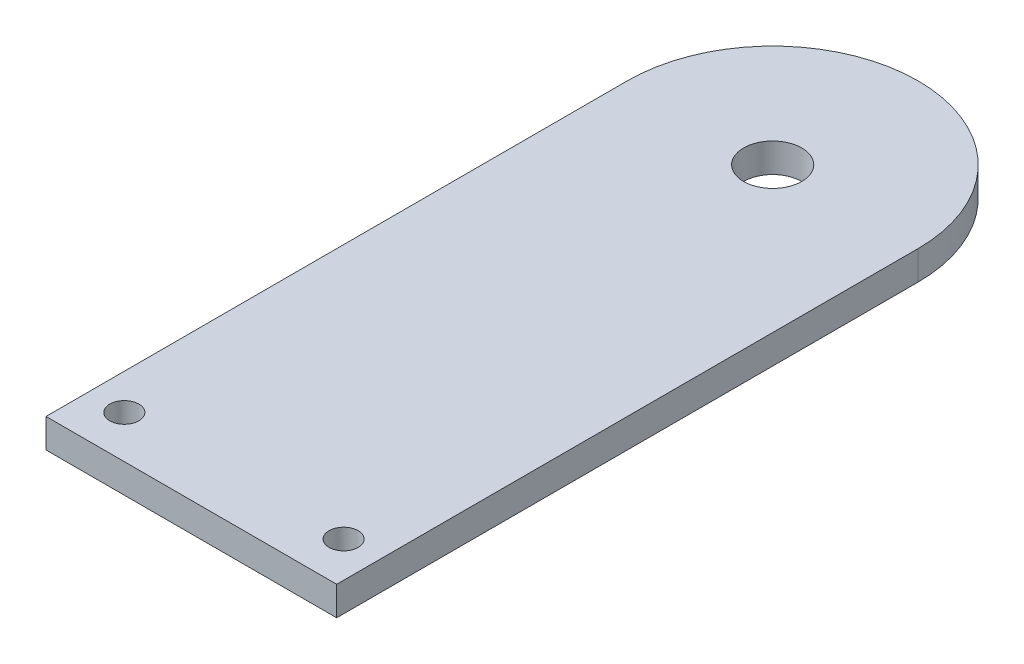
from build123d import *

# Parameters (mm, degrees)
SKETCH1_R           = 5
SKETCH1_R_2         = 2.5
BOSS_EXTRUDE1_DEPTH = 5


with BuildPart() as part:
    # Sketch1 → Boss-Extrude1 (new body)
    with BuildSketch(Plane(origin=(0, 0, 0), x_dir=(1, 0, 0), z_dir=(0, 1, 0))):
        with BuildLine():
            Line((0, 0), (50, 0))
            Line((50, 0), (50, 100))
            ThreePointArc((50, 100), (25, 125), (0, 100))
            Line((0, 100), (0, 0))
        make_face()
        with Locations(Location((25, 100, 0), (0, 0, 270))):
            Circle(SKETCH1_R, mode=Mode.SUBTRACT)
        with Locations(Location((6.140064067, 7.331061288, 0), (0, 0, 270))):
            Circle(SKETCH1_R_2, mode=Mode.SUBTRACT)
        with Locations(Location((43.859935933, 7.331061288, 0), (0, 0, 90))):
            Circle(SKETCH1_R_2, mode=Mode.SUBTRACT)
    extrude(amount=BOSS_EXTRUDE1_DEPTH)


solid = part.part
